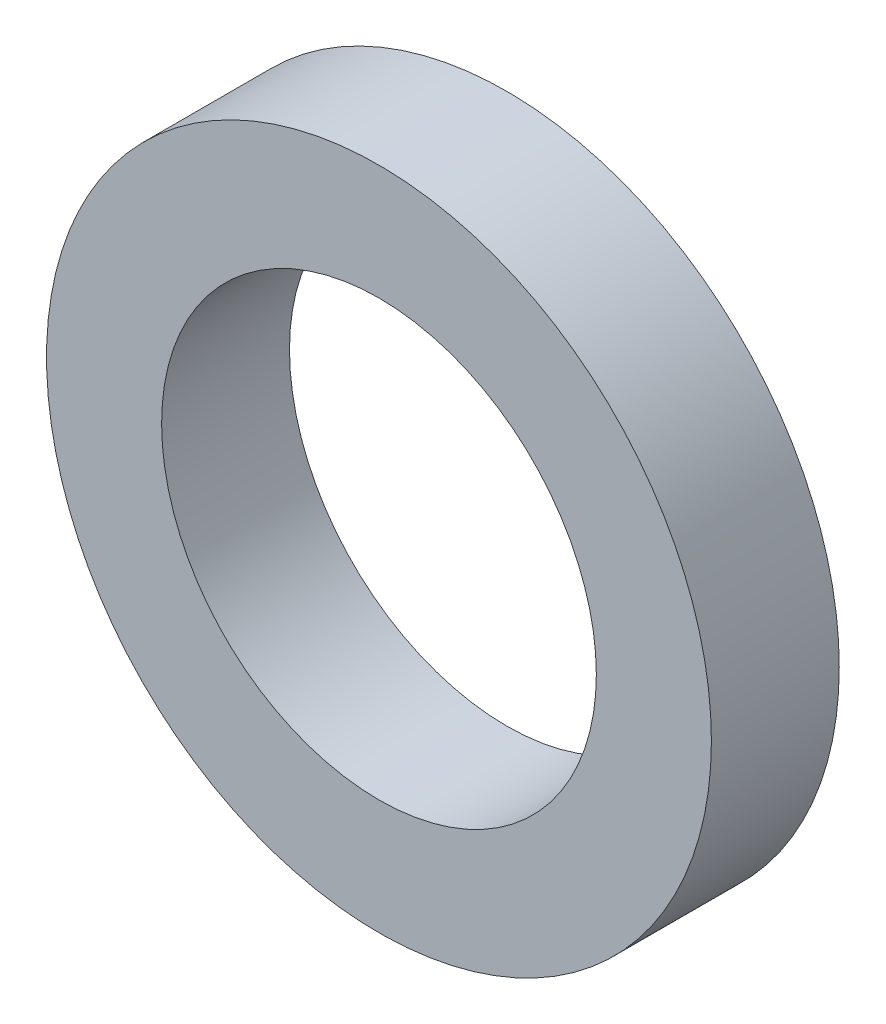
from build123d import *

# Parameters (mm, degrees)
SKIZZE1_R                       = 13
SKIZZE1_R_2                     = 8.5
AUFSATZ_LINEAR_AUSTRAGEN1_DEPTH = 5


with BuildPart() as part:
    # Skizze1 → Aufsatz-Linear austragen1 (new body)
    with BuildSketch(Plane.XY):
        Circle(SKIZZE1_R)
        Circle(SKIZZE1_R_2, mode=Mode.SUBTRACT)
    extrude(amount=AUFSATZ_LINEAR_AUSTRAGEN1_DEPTH)


solid = part.part
